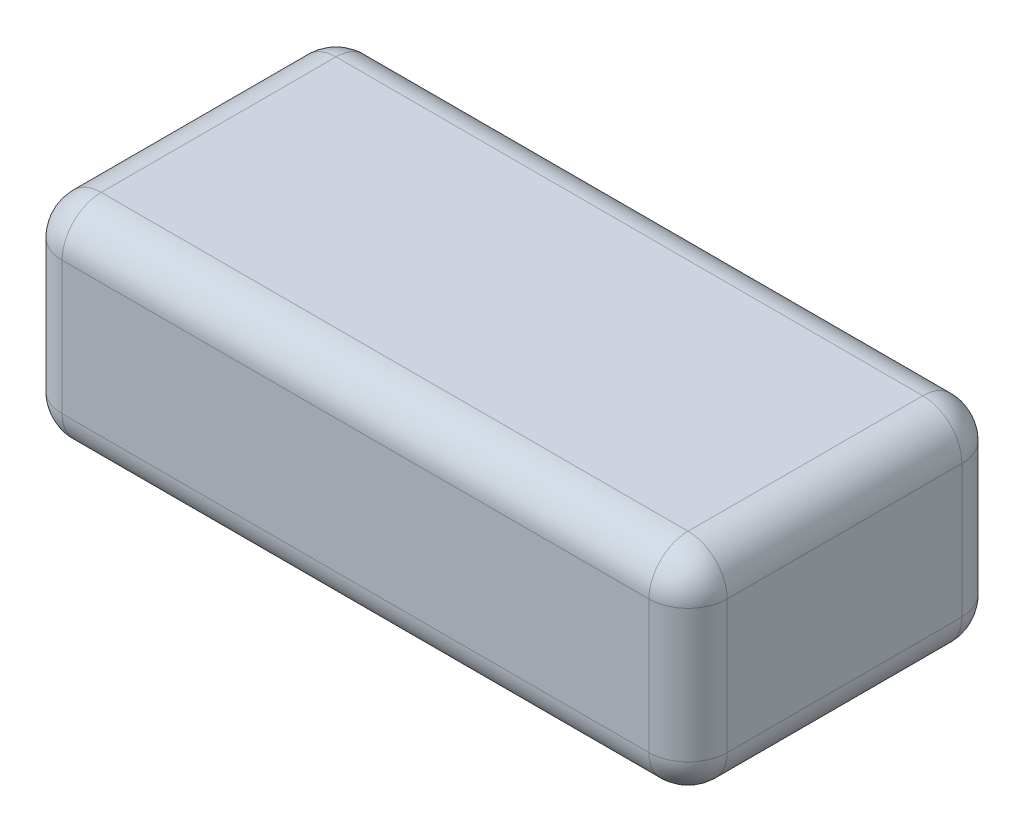
from build123d import *

# Parameters (mm, degrees)
SKETCH_1_W      = 85
SKETCH_1_H      = 40
EXTRUDE_1_DEPTH = 13.5
FILLET_1_R      = 5


with BuildPart() as part:
    # 草图1 → 凸台-拉伸1 (new, symmetric)
    with BuildSketch(Plane(origin=(0, 0, 0), x_dir=(1, 0, 0), z_dir=(0, 1, 0))):
        Rectangle(SKETCH_1_W, SKETCH_1_H)
    extrude(amount=EXTRUDE_1_DEPTH, both=True)

    # 圆角1
    fillet_1_edges = [part.edges().sort_by_distance(p)[0] for p in [
        (42.5, 13.5, 0),
        (0, 13.5, -20),
        (-42.5, 13.5, 0),
        (0, -13.5, -20),
        (42.5, -13.5, 0),
        (0, -13.5, 20),
        (-42.5, -13.5, 0),
        (0, 13.5, 20),
        (-42.5, 0, -20),
        (42.5, 0, -20),
        (42.5, 0, 20),
        (-42.5, 0, 20),
    ]]
    fillet(fillet_1_edges, radius=FILLET_1_R)


solid = part.part
